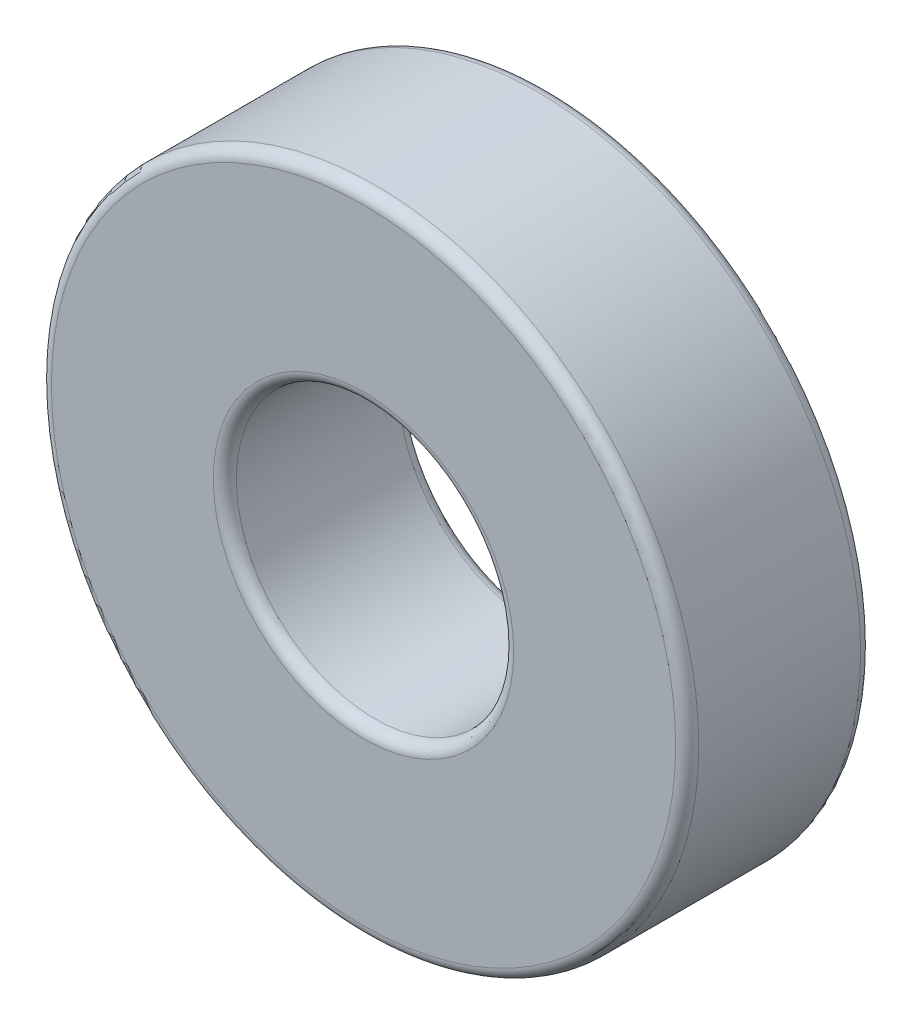
from build123d import *

# Parameters (mm, degrees)
ESQUISSE1_R        = 14
ESQUISSE1_R_2      = 6
BOSS_EXTRU_1_DEPTH = 8
CONG_1_R           = 0.5


with BuildPart() as part:
    # Esquisse1 → Boss.-Extru.1 (new body)
    with BuildSketch(Plane.XY):
        Circle(ESQUISSE1_R)
        Circle(ESQUISSE1_R_2, mode=Mode.SUBTRACT)
    extrude(amount=BOSS_EXTRU_1_DEPTH)

    # Congé1
    cong_1_edges = [part.edges().sort_by_distance(p)[0] for p in [
        (-14, 0, 0),
        (-14, 0, 8),
        (-6, 0, 0),
        (-6, 0, 8),
    ]]
    fillet(cong_1_edges, radius=CONG_1_R)


solid = part.part
